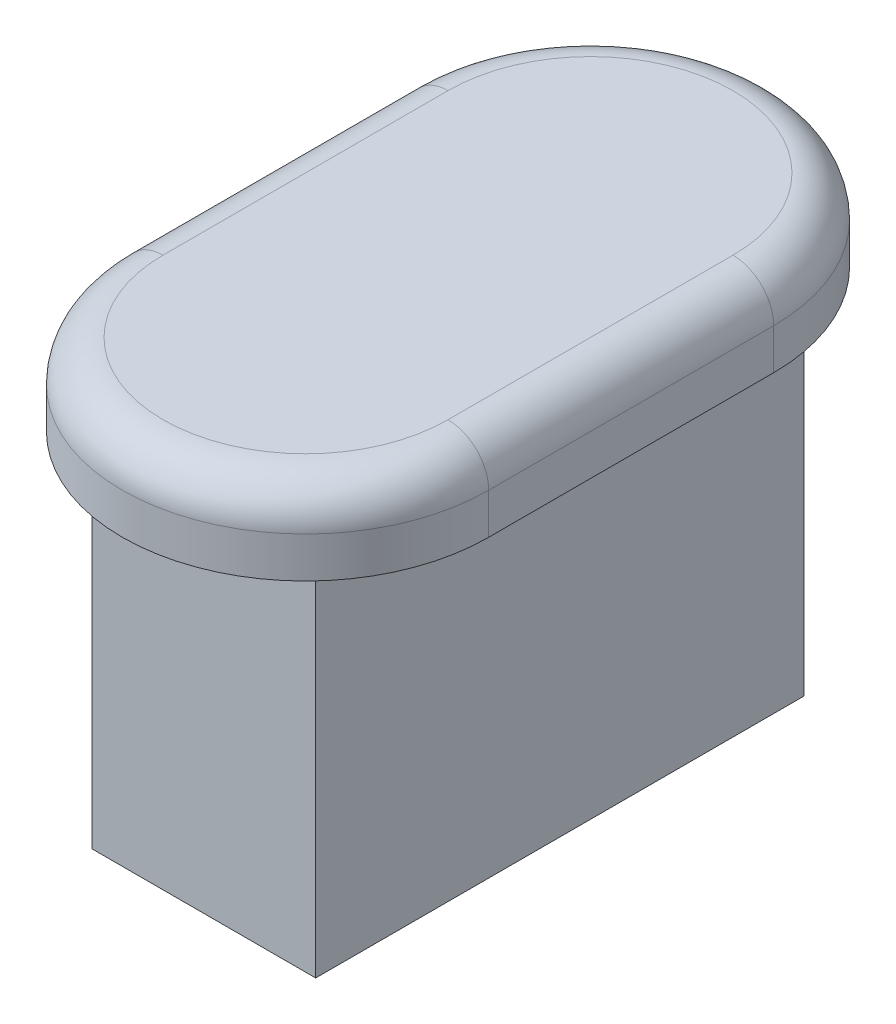
from build123d import *

# Parameters (mm, degrees)
SKETCH_1_W      = 5.5
SKETCH_1_H      = 12
EXTRUDE_1_DEPTH = 9
EXTRUDE_2_DEPTH = 2
FILLET_1_R      = 1


with BuildPart() as part:
    # Эскиз1 → Бобышка-Вытянуть1 (new body)
    with BuildSketch(Plane(origin=(0, 0, 0), x_dir=(1, 0, 0), z_dir=(0, 1, 0))):
        with Locations((-2.858040201, -0.090452261)):
            Rectangle(SKETCH_1_W, SKETCH_1_H)
    extrude(amount=EXTRUDE_1_DEPTH)

    # Эскиз3 → Бобышка-Вытянуть2 (add)
    with BuildSketch(Plane(origin=(0, 9, 0), x_dir=(1, 0, 0), z_dir=(0, 1, 0))):
        with BuildLine():
            Line((1.641959799, 3.409547739), (1.641959799, -3.590452261))
            ThreePointArc((1.641959799, -3.590452261), (-2.858040201, -8.090452261), (-7.358040201, -3.590452261))
            Line((-7.358040201, -3.590452261), (-7.358040201, 3.409547739))
            ThreePointArc((-7.358040201, 3.409547739), (-2.858040201, 7.909547739), (1.641959799, 3.409547739))
        make_face()
    extrude(amount=EXTRUDE_2_DEPTH)

    # Скругление1
    fillet_1_edges = [part.edges().sort_by_distance(p)[0] for p in [
        (-2.858040201, 11, -7.909547739),
        (-7.358040201, 11, 0.090452261),
        (-2.858040201, 11, 8.090452261),
        (1.641959799, 11, 0.090452261),
    ]]
    fillet(fillet_1_edges, radius=FILLET_1_R)


solid = part.part
